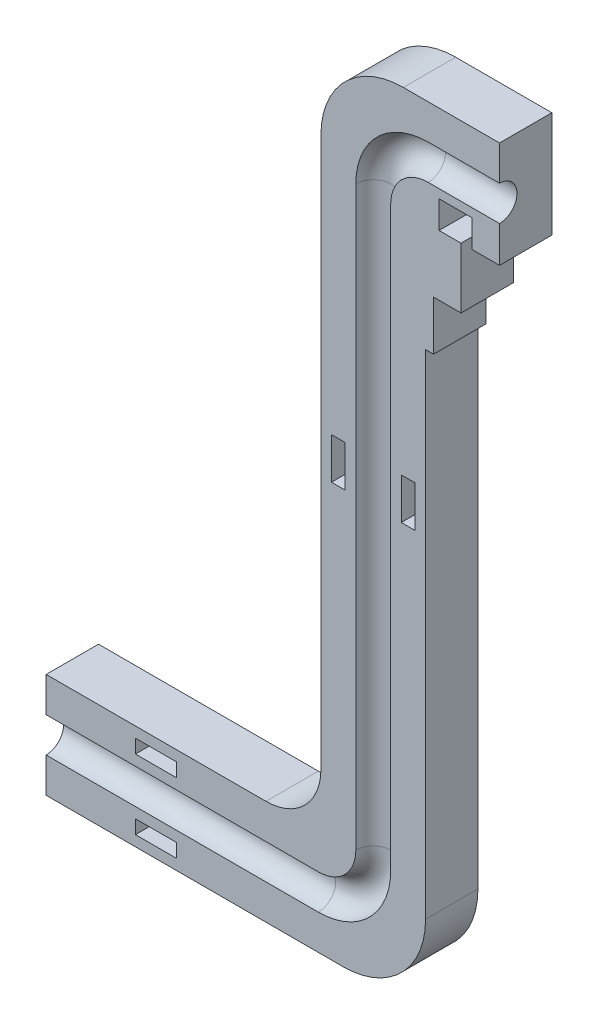
from build123d import *

# Parameters (mm, degrees)
BOSS_EXTRUDE1_DEPTH  = 19.05
FILLET1_R            = 30
FILLET2_R            = 20
BOSS_EXTRUDE3_DEPTH  = 19.05
SKETCH14_W           = 12
SKETCH14_H           = 10
CUT_EXTRUDE1_DEPTH   = 39
CUT_SWEEP1_PROFILE_R = 6.35
SKETCH24_W           = 5
SKETCH24_H           = 15
SKETCH24_W_2         = 15
SKETCH24_H_2         = 5
CUT_EXTRUDE2_DEPTH   = 10


with BuildPart() as part:
    # Sketch1 → Boss-Extrude1 (new body)
    with BuildSketch(Plane.XY):
        Polygon((-100, 0), (0, 0), (0, 250), (65, 250), (65, 211.9), (38.1, 211.9), (38.1, -38.1), (-100, -38.1), align=None)
    extrude(amount=BOSS_EXTRUDE1_DEPTH)

    # Fillet1
    fillet1_edges = [part.edges().sort_by_distance(p)[0] for p in [
        (0, 250, 9.525),
        (38.1, -38.1, 9.525),
    ]]
    fillet(fillet1_edges, radius=FILLET1_R)

    # Fillet2
    fillet2_edges = [part.edges().sort_by_distance(p)[0] for p in [
        (0, 0, 9.525),
    ]]
    fillet(fillet2_edges, radius=FILLET2_R)

    # Sketch13 → Boss-Extrude3 (add)
    with BuildSketch(Plane.XY.offset(19.05)):
        Polygon((55, 221.425), (43, 221.425), (43, 211.425), (51, 211.425), (51, 189.425), (41, 189.425), (41, 171.425), (36.549895251, 171.425), (36.549895251, 223.572995821), (65, 223.572995821), (65, 211.9), (65, 211.425), (55, 211.425), align=None)
    extrude(amount=-BOSS_EXTRUDE3_DEPTH)

    # Sketch14 → Cut-Extrude1 (cut)
    with BuildSketch(Plane.XY.offset(19.05)):
        with Locations((49, 216.42)):
            Rectangle(SKETCH14_W, SKETCH14_H)
    extrude(amount=-CUT_EXTRUDE1_DEPTH, mode=Mode.SUBTRACT)

    # Cut-Sweep1: sweep along a path in Sketch17
    with BuildLine(Plane.XY.offset(19.05)) as cut_sweep1_path:
        Line((65, 230.95), (39.05, 230.95))
        ThreePointArc((39.05, 230.95), (24.907864376, 225.092135624), (19.05, 210.95))
        Line((19.05, 210.95), (19.05, 0.95))
        ThreePointArc((19.05, 0.95), (13.192135624, -13.192135624), (-0.95, -19.05))
        Line((-0.95, -19.05), (-100, -19.05))
    # Cut-Sweep1 profile (on start of the path) → Cut-Sweep1 (sweep, cut)
    with BuildSketch(Plane(origin=(65, 230.95, 19.05), x_dir=(0, 0, -1), z_dir=(-1, 0, 0))):
        Circle(CUT_SWEEP1_PROFILE_R)
    sweep(path=cut_sweep1_path.line, mode=Mode.SUBTRACT)

    # Sketch24 → Cut-Extrude2 (cut)
    with BuildSketch(Plane.XY.offset(19.05)):
        with Locations((6.35, 120)):
            Rectangle(SKETCH24_W, SKETCH24_H)
        with Locations((-60, -6.35)):
            Rectangle(SKETCH24_W_2, SKETCH24_H_2)
        with Locations((31.75, 120)):
            Rectangle(SKETCH24_W, SKETCH24_H)
        with Locations((-60, -31.75)):
            Rectangle(SKETCH24_W_2, SKETCH24_H_2)
    extrude(amount=-CUT_EXTRUDE2_DEPTH, mode=Mode.SUBTRACT)


solid = part.part
